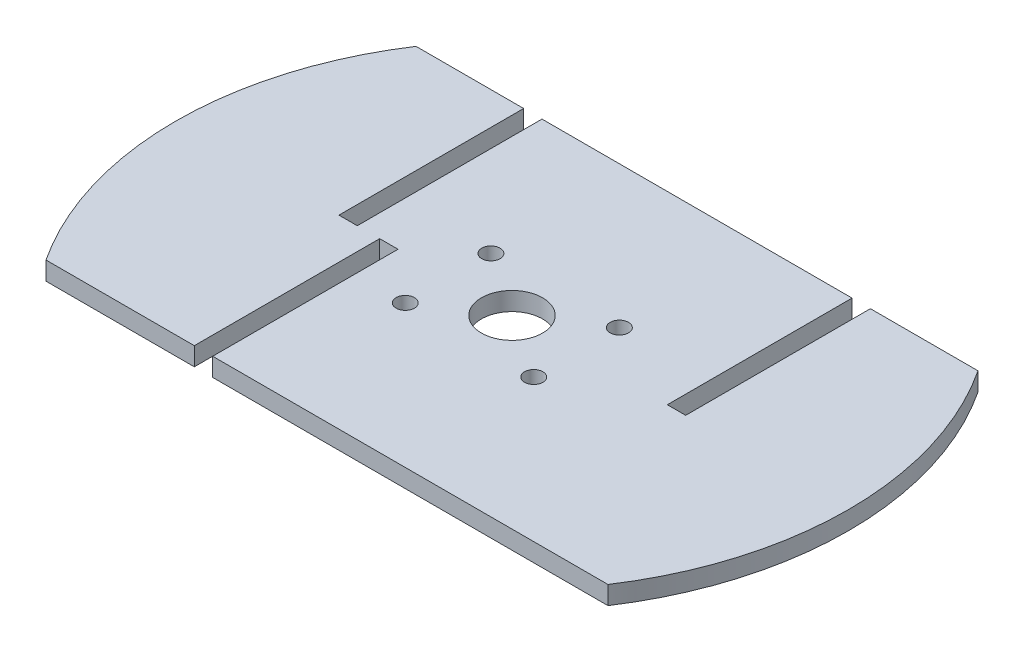
from build123d import *

# Parameters (mm, degrees)
BOSS_EXTRUDE1_DEPTH = 3
SKETCH4_R           = 5
CUT_EXTRUDE1_DEPTH  = 3
SKETCH6_R           = 1.5
CUT_EXTRUDE2_DEPTH  = 3
CUT_EXTRUDE3_DEPTH  = 3
SKETCH8_W           = 3
SKETCH8_H           = 30.3
CUT_EXTRUDE4_DEPTH  = 3


with BuildPart() as part:
    # Sketch3 → Boss-Extrude1 (new body)
    with BuildSketch(Plane(origin=(0, 0, 0), x_dir=(1, 0, 0), z_dir=(0, 1, 0))):
        with BuildLine():
            Line((-42.11236018, 3.702994226), (-22.11236018, 3.702994226))
            Line((-22.11236018, 3.702994226), (-22.11236018, -26.497005774))
            Line((-22.11236018, -26.497005774), (-19.11236018, -26.497005774))
            Line((-19.11236018, -26.497005774), (-19.11236018, 3.702994226))
            Line((-19.11236018, 3.702994226), (-15.45236018, 3.702994226))
            Line((-15.45236018, 3.702994226), (-12.45236018, 3.702994226))
            Line((-12.45236018, 3.702994226), (31.57763982, 3.702994226))
            Line((31.57763982, 3.702994226), (31.57763982, -26.497005774))
            Line((31.57763982, -26.497005774), (34.57763982, -26.497005774))
            Line((34.57763982, -26.497005774), (34.57763982, 3.702994226))
            Line((34.57763982, 3.702994226), (54.57763982, 3.702994226))
            ThreePointArc((54.57763982, 3.702994226), (61.648707631, 0.774062038), (64.57763982, -6.297005774))
            Line((64.57763982, -6.297005774), (64.57763982, -46.797005774))
            ThreePointArc((64.57763982, -46.797005774), (61.648707631, -53.868073586), (54.57763982, -56.797005774))
            Line((54.57763982, -56.797005774), (-42.11236018, -56.797005774))
            ThreePointArc((-42.11236018, -56.797005774), (-49.183427992, -53.868073586), (-52.11236018, -46.797005774))
            Line((-52.11236018, -46.797005774), (-52.11236018, -6.297005774))
            ThreePointArc((-52.11236018, -6.297005774), (-49.183427992, 0.774062038), (-42.11236018, 3.702994226))
        make_face()
    extrude(amount=BOSS_EXTRUDE1_DEPTH)

    # Sketch4 → Cut-Extrude1 (cut)
    with BuildSketch(Plane(origin=(0, 3, 0), x_dir=(1, 0, 0), z_dir=(0, 1, 0))):
        with Locations(Location((6.23263982, -26.547005774, 0), (0, 0, 270))):
            Circle(SKETCH4_R)
    extrude(amount=-CUT_EXTRUDE1_DEPTH, mode=Mode.SUBTRACT)

    # Sketch6 → Cut-Extrude2 (cut)
    with BuildSketch(Plane(origin=(0, 3, 0), x_dir=(1, 0, 0), z_dir=(0, 1, 0))):
        with Locations(Location((-4.26736018, -19.497005774, 0), (0, 0, 270))):
            Circle(SKETCH6_R)
        with Locations(Location((-4.26736018, -33.497005774, 0), (0, 0, 270))):
            Circle(SKETCH6_R)
        with Locations(Location((16.73263982, -19.497005774, 0), (0, 0, 270))):
            Circle(SKETCH6_R)
        with Locations(Location((16.73263982, -33.497005774, 0), (0, 0, 270))):
            Circle(SKETCH6_R)
    extrude(amount=-CUT_EXTRUDE2_DEPTH, mode=Mode.SUBTRACT)

    # Sketch7 → Cut-Extrude3 (cut)
    with BuildSketch(Plane(origin=(0, 3, 0), x_dir=(1, 0, 0), z_dir=(0, 1, 0))):
        with BuildLine():
            Line((52.166695813, 3.702994226), (73.459164028, 3.702994226))
            Line((73.459164028, 3.702994226), (73.459164028, -56.797005774))
            Line((73.459164028, -56.797005774), (52.166695813, -56.797005774))
            ThreePointArc((52.166695813, -56.797005774), (61.23263982, -26.547005774), (52.166695813, 3.702994226))
        make_face()
        with BuildLine():
            Line((-39.701416174, 3.702994226), (-60.819947715, 3.702994226))
            Line((-60.819947715, 3.702994226), (-60.819947715, -56.797005774))
            Line((-60.819947715, -56.797005774), (-39.701416174, -56.797005774))
            ThreePointArc((-39.701416174, -56.797005774), (-48.76736018, -26.547005774), (-39.701416174, 3.702994226))
        make_face()
    extrude(amount=-CUT_EXTRUDE3_DEPTH, mode=Mode.SUBTRACT)

    # Sketch8 → Cut-Extrude4 (cut)
    with BuildSketch(Plane(origin=(0, 3, 0), x_dir=(1, 0, 0), z_dir=(0, 1, 0))):
        with Locations((-13.95236018, -41.647005774)):
            Rectangle(SKETCH8_W, SKETCH8_H)
    extrude(amount=-CUT_EXTRUDE4_DEPTH, mode=Mode.SUBTRACT)


solid = part.part
